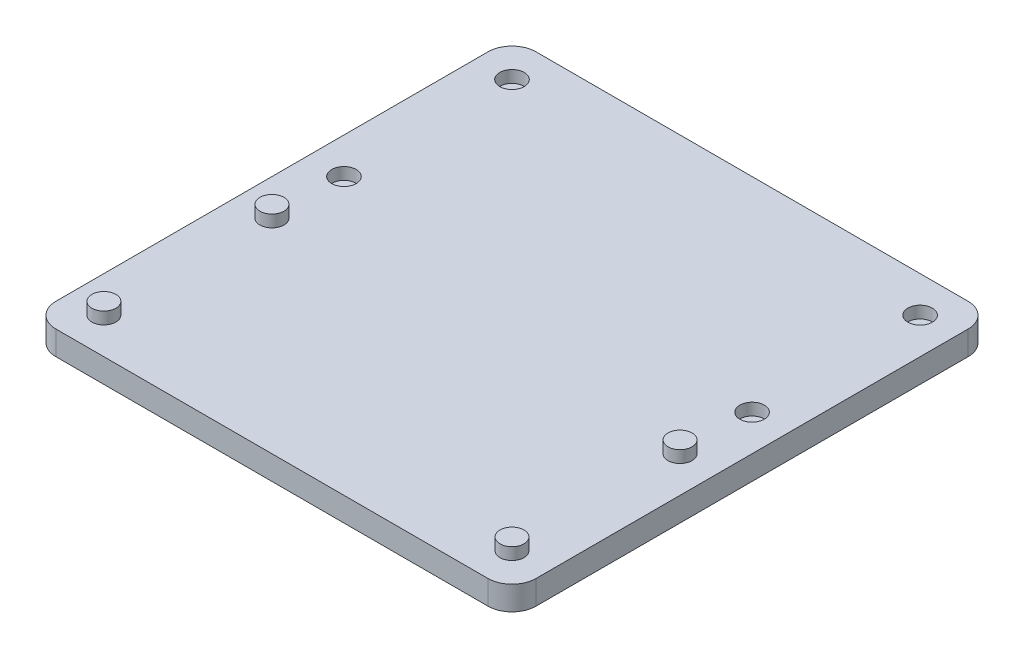
from build123d import *

# Parameters (mm, degrees)
SKETCH_1_W          = 200
SKETCH_1_H          = 200
EXTRUDE_1_DEPTH     = 10
SKETCH_2_R          = 5
EXTRUDE_2_DEPTH     = 5
FILLET_1_R          = 10
SKETCH_3_R          = 5.1
CUT_EXTRUDE_1_DEPTH = 5


with BuildPart() as part:
    # ｽｹｯﾁ1 → ﾎﾞｽ - 押し出し1 (new body)
    with BuildSketch(Plane(origin=(0, 0, 0), x_dir=(1, 0, 0), z_dir=(0, 1, 0))):
        Rectangle(SKETCH_1_W, SKETCH_1_H)
    extrude(amount=EXTRUDE_1_DEPTH)

    # ｽｹｯﾁ2 → ﾎﾞｽ - 押し出し2 (add)
    with BuildSketch(Plane(origin=(0, 10, 0), x_dir=(1, 0, 0), z_dir=(0, 1, 0))):
        with Locations(Location((-85, -15, 0), (0, 0, 90))):
            Circle(SKETCH_2_R)
        with Locations(Location((-85, -85, 0), (0, 0, 90))):
            Circle(SKETCH_2_R)
        with Locations(Location((85, -85, 0), (0, 0, 90))):
            Circle(SKETCH_2_R)
        with Locations(Location((85, -15, 0), (0, 0, 90))):
            Circle(SKETCH_2_R)
    extrude(amount=EXTRUDE_2_DEPTH)

    # ﾌｨﾚｯﾄ1
    fillet_1_edges = [part.edges().sort_by_distance(p)[0] for p in [
        (100, 5, 100),
        (-100, 5, 100),
        (-100, 5, -100),
        (100, 5, -100),
    ]]
    fillet(fillet_1_edges, radius=FILLET_1_R)

    # ｽｹｯﾁ3 → ｶｯﾄ - 押し出し1 (cut)
    with BuildSketch(Plane(origin=(0, 10, 0), x_dir=(1, 0, 0), z_dir=(0, 1, 0))):
        with Locations(Location((-85, 85, 0), (0, 0, 270))):
            Circle(SKETCH_3_R)
        with Locations(Location((85, 85, 0), (0, 0, 270))):
            Circle(SKETCH_3_R)
        with Locations(Location((-85, 15, 0), (0, 0, 270))):
            Circle(SKETCH_3_R)
        with Locations(Location((85, 15, 0), (0, 0, 270))):
            Circle(SKETCH_3_R)
    extrude(amount=-CUT_EXTRUDE_1_DEPTH, mode=Mode.SUBTRACT)


solid = part.part
